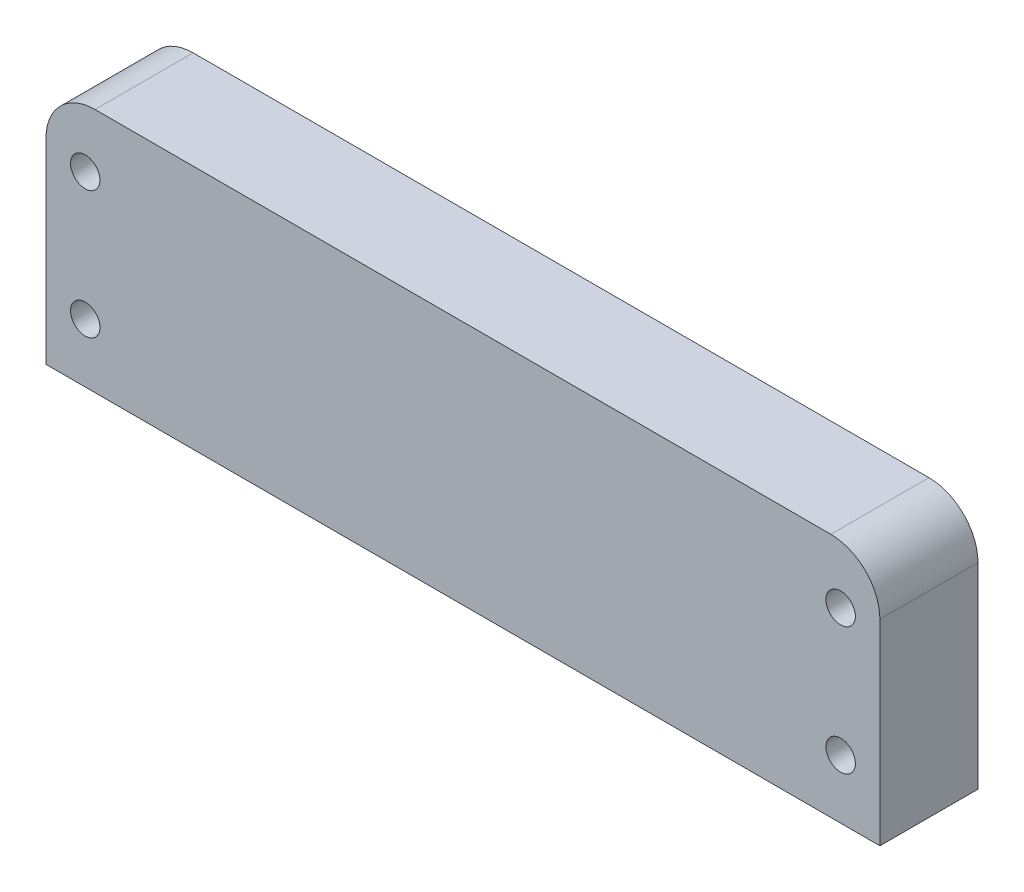
from build123d import *

# Parameters (mm, degrees)
EXTRUDE_383_DEPTH      = 5
EXTRUDE_383_DEPTH_BACK = 5
SKETCH_1_W             = 85
SKETCH_1_H             = 25
SKETCH_4_R             = 1.5
CUT_EXTRUDE_595_DEPTH  = 46.414755311
SKETCH_6_R             = 1.25
CUT_EXTRUDE_761_DEPTH  = 10
FILLET_2_R             = 5


with BuildPart() as part:
    # Эскиз1 → Extrude 383 (new, two sides: drawn at the far end of the back side and taken through both)
    with BuildSketch(Plane.XY.offset(-EXTRUDE_383_DEPTH_BACK)):
        Rectangle(SKETCH_1_W, SKETCH_1_H)
    extrude(amount=EXTRUDE_383_DEPTH + EXTRUDE_383_DEPTH_BACK)

    # Эскиз4 → Cut-Extrude 595 (cut, through all)
    with BuildSketch(Plane.XY.offset(5)):
        with Locations((-38.5, 6.5)):
            Circle(SKETCH_4_R)
        with Locations((38.5, 6.5)):
            Circle(SKETCH_4_R)
        with Locations((38.5, -6.5)):
            Circle(SKETCH_4_R)
        with Locations((-38.5, -6.5)):
            Circle(SKETCH_4_R)
    extrude(amount=-CUT_EXTRUDE_595_DEPTH, mode=Mode.SUBTRACT)

    # Эскиз6 → Cut-Extrude 761 (cut)
    with BuildSketch(Plane.XZ.offset(12.5)):
        with Locations((-20, 0)):
            Circle(SKETCH_6_R)
        with Locations((20, 0)):
            Circle(SKETCH_6_R)
    extrude(amount=-CUT_EXTRUDE_761_DEPTH, mode=Mode.SUBTRACT)

    # Скругление2
    fillet_2_edges = [part.edges().sort_by_distance(p)[0] for p in [
        (-42.5, 12.5, 0),
        (42.5, 12.5, 0),
    ]]
    fillet(fillet_2_edges, radius=FILLET_2_R)


solid = part.part
